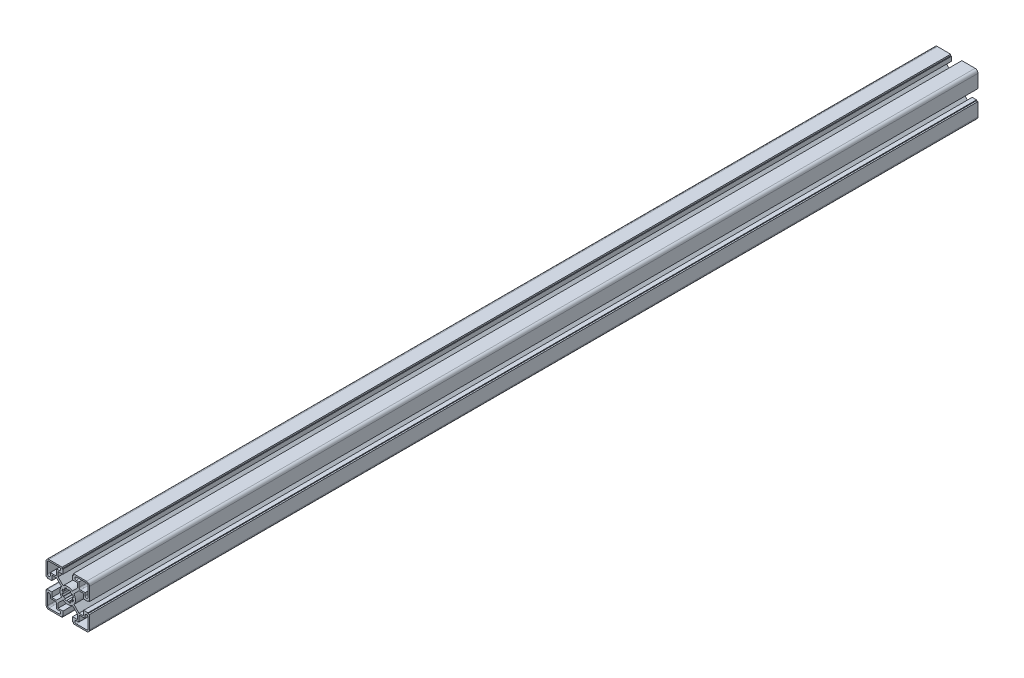
from build123d import *

# Parameters (mm, degrees)
BOSS_EXTRUDE1_DEPTH = 460


with BuildPart() as part:
    # Sketch1 → Boss-Extrude1 (new, symmetric)
    with BuildSketch(Plane.XY):
        with BuildLine():
            Line((-19.5072, 22.5044), (-5.7912, 22.5044))
            Line((-5.7912, 22.5044), (-5.7912, 21.0058))
            Line((-5.7912, 21.0058), (-5.0038, 21.0058))
            Line((-5.0038, 21.0058), (-5.0038, 16.51))
            Line((-5.0038, 16.51), (-10.0457, 16.51))
            Line((-10.0457, 16.51), (-10.0457, 11.680106614))
            Line((-10.0457, 11.680106614), (-4.781026704, 6.415433318))
            ThreePointArc((-4.781026704, 6.415433318), (0, 8.001), (4.781026704, 6.415433318))
            Line((4.781026704, 6.415433318), (10.0457, 11.680106614))
            Line((10.0457, 11.680106614), (10.0457, 16.51))
            Line((10.0457, 16.51), (5.0038, 16.51))
            Line((5.0038, 16.51), (5.0038, 21.0058))
            Line((5.0038, 21.0058), (5.7912, 21.0058))
            Line((5.7912, 21.0058), (5.7912, 22.5044))
            Line((5.7912, 22.5044), (19.5072, 22.5044))
            ThreePointArc((19.5072, 22.5044), (21.626540445, 21.626540445), (22.5044, 19.5072))
            Line((22.5044, 19.5072), (22.5044, 5.7912))
            Line((22.5044, 5.7912), (21.0058, 5.7912))
            Line((21.0058, 5.7912), (21.0058, 5.0038))
            Line((21.0058, 5.0038), (16.51, 5.0038))
            Line((16.51, 5.0038), (16.51, 10.0457))
            Line((16.51, 10.0457), (11.680106614, 10.0457))
            Line((11.680106614, 10.0457), (6.415433318, 4.781026704))
            ThreePointArc((6.415433318, 4.781026704), (8.001, 0), (6.415433318, -4.781026704))
            Line((6.415433318, -4.781026704), (11.680106614, -10.0457))
            Line((11.680106614, -10.0457), (16.51, -10.0457))
            Line((16.51, -10.0457), (16.51, -5.0038))
            Line((16.51, -5.0038), (21.0058, -5.0038))
            Line((21.0058, -5.0038), (21.0058, -5.7912))
            Line((21.0058, -5.7912), (22.5044, -5.7912))
            Line((22.5044, -5.7912), (22.5044, -19.5072))
            ThreePointArc((22.5044, -19.5072), (21.626540445, -21.626540445), (19.5072, -22.5044))
            Line((19.5072, -22.5044), (5.7912, -22.5044))
            Line((5.7912, -22.5044), (5.7912, -21.0058))
            Line((5.7912, -21.0058), (5.0038, -21.0058))
            Line((5.0038, -21.0058), (5.0038, -16.51))
            Line((5.0038, -16.51), (10.0457, -16.51))
            Line((10.0457, -16.51), (10.0457, -11.680106614))
            Line((10.0457, -11.680106614), (4.781026704, -6.415433318))
            ThreePointArc((4.781026704, -6.415433318), (0, -8.001), (-4.781026704, -6.415433318))
            Line((-4.781026704, -6.415433318), (-10.0457, -11.680106614))
            Line((-10.0457, -11.680106614), (-10.0457, -16.51))
            Line((-10.0457, -16.51), (-5.0038, -16.51))
            Line((-5.0038, -16.51), (-5.0038, -21.0058))
            Line((-5.0038, -21.0058), (-5.7912, -21.0058))
            Line((-5.7912, -21.0058), (-5.7912, -22.5044))
            Line((-5.7912, -22.5044), (-19.5072, -22.5044))
            ThreePointArc((-19.5072, -22.5044), (-21.626540445, -21.626540445), (-22.5044, -19.5072))
            Line((-22.5044, -19.5072), (-22.5044, -5.7912))
            Line((-22.5044, -5.7912), (-21.0058, -5.7912))
            Line((-21.0058, -5.7912), (-21.0058, -5.0038))
            Line((-21.0058, -5.0038), (-16.51, -5.0038))
            Line((-16.51, -5.0038), (-16.51, -10.0457))
            Line((-16.51, -10.0457), (-11.680106614, -10.0457))
            Line((-11.680106614, -10.0457), (-6.415433318, -4.781026704))
            ThreePointArc((-6.415433318, -4.781026704), (-8.001, 0), (-6.415433318, 4.781026704))
            Line((-6.415433318, 4.781026704), (-11.680106614, 10.0457))
            Line((-11.680106614, 10.0457), (-16.51, 10.0457))
            Line((-16.51, 10.0457), (-16.51, 5.0038))
            Line((-16.51, 5.0038), (-21.0058, 5.0038))
            Line((-21.0058, 5.0038), (-21.0058, 5.7912))
            Line((-21.0058, 5.7912), (-22.5044, 5.7912))
            Line((-22.5044, 5.7912), (-22.5044, 19.5072))
            ThreePointArc((-22.5044, 19.5072), (-21.626540445, 21.626540445), (-19.5072, 22.5044))
        make_face()
        with BuildLine():
            Line((-18.0086, 11.5443), (-13.0429, 11.5443))
            ThreePointArc((-13.0429, 11.5443), (-11.983229778, 11.983229778), (-11.5443, 13.0429))
            Line((-11.5443, 13.0429), (-11.5443, 18.0086))
            Line((-11.5443, 18.0086), (-8.7884, 18.0086))
            ThreePointArc((-8.7884, 18.0086), (-7.2898, 19.5072), (-8.7884, 21.0058))
            Line((-8.7884, 21.0058), (-19.5072, 21.0058))
            ThreePointArc((-19.5072, 21.0058), (-20.566870222, 20.566870222), (-21.0058, 19.5072))
            Line((-21.0058, 19.5072), (-21.0058, 8.7884))
            ThreePointArc((-21.0058, 8.7884), (-19.5072, 7.2898), (-18.0086, 8.7884))
            Line((-18.0086, 8.7884), (-18.0086, 11.5443))
        make_face(mode=Mode.SUBTRACT)
        with BuildLine():
            Line((1.189270603, 5.978867069), (0.976192953, 4.907653386))
            ThreePointArc((0.976192953, 4.907653386), (0, 5.0038), (-0.976192953, 4.907653386))
            Line((-0.976192953, 4.907653386), (-1.189270603, 5.978867069))
            ThreePointArc((-1.189270603, 5.978867069), (-2.332838204, 5.63196963), (-3.38675614, 5.068638757))
            Line((-3.38675614, 5.068638757), (-2.779962332, 4.160507646))
            ThreePointArc((-2.779962332, 4.160507646), (-3.538220912, 3.538220912), (-4.160507646, 2.779962332))
            Line((-4.160507646, 2.779962332), (-5.068638757, 3.38675614))
            ThreePointArc((-5.068638757, 3.38675614), (-5.63196963, 2.332838204), (-5.978867069, 1.189270603))
            Line((-5.978867069, 1.189270603), (-4.907653386, 0.976192953))
            ThreePointArc((-4.907653386, 0.976192953), (-5.0038, 0), (-4.907653386, -0.976192953))
            Line((-4.907653386, -0.976192953), (-5.978867069, -1.189270603))
            ThreePointArc((-5.978867069, -1.189270603), (-5.63196963, -2.332838204), (-5.068638757, -3.38675614))
            Line((-5.068638757, -3.38675614), (-4.160507646, -2.779962332))
            ThreePointArc((-4.160507646, -2.779962332), (-3.538220912, -3.538220912), (-2.779962332, -4.160507646))
            Line((-2.779962332, -4.160507646), (-3.38675614, -5.068638757))
            ThreePointArc((-3.38675614, -5.068638757), (-2.332838204, -5.63196963), (-1.189270603, -5.978867069))
            Line((-1.189270603, -5.978867069), (-0.976192953, -4.907653386))
            ThreePointArc((-0.976192953, -4.907653386), (0, -5.0038), (0.976192953, -4.907653386))
            Line((0.976192953, -4.907653386), (1.189270603, -5.978867069))
            ThreePointArc((1.189270603, -5.978867069), (2.332838204, -5.63196963), (3.38675614, -5.068638757))
            Line((3.38675614, -5.068638757), (2.779962332, -4.160507646))
            ThreePointArc((2.779962332, -4.160507646), (3.538220912, -3.538220912), (4.160507646, -2.779962332))
            Line((4.160507646, -2.779962332), (5.068638757, -3.38675614))
            ThreePointArc((5.068638757, -3.38675614), (5.63196963, -2.332838204), (5.978867069, -1.189270603))
            Line((5.978867069, -1.189270603), (4.907653386, -0.976192953))
            ThreePointArc((4.907653386, -0.976192953), (5.0038, 0), (4.907653386, 0.976192953))
            Line((4.907653386, 0.976192953), (5.978867069, 1.189270603))
            ThreePointArc((5.978867069, 1.189270603), (5.63196963, 2.332838204), (5.068638757, 3.38675614))
            Line((5.068638757, 3.38675614), (4.160507646, 2.779962332))
            ThreePointArc((4.160507646, 2.779962332), (3.538220912, 3.538220912), (2.779962332, 4.160507646))
            Line((2.779962332, 4.160507646), (3.38675614, 5.068638757))
            ThreePointArc((3.38675614, 5.068638757), (2.332838204, 5.63196963), (1.189270603, 5.978867069))
        make_face(mode=Mode.SUBTRACT)
        with BuildLine():
            Line((11.5443, 18.0086), (8.7884, 18.0086))
            ThreePointArc((8.7884, 18.0086), (7.2898, 19.5072), (8.7884, 21.0058))
            Line((8.7884, 21.0058), (19.5072, 21.0058))
            ThreePointArc((19.5072, 21.0058), (20.566870222, 20.566870222), (21.0058, 19.5072))
            Line((21.0058, 19.5072), (21.0058, 8.7884))
            ThreePointArc((21.0058, 8.7884), (19.5072, 7.2898), (18.0086, 8.7884))
            Line((18.0086, 8.7884), (18.0086, 11.5443))
            Line((18.0086, 11.5443), (13.0429, 11.5443))
            ThreePointArc((13.0429, 11.5443), (11.983229778, 11.983229778), (11.5443, 13.0429))
            Line((11.5443, 13.0429), (11.5443, 18.0086))
        make_face(mode=Mode.SUBTRACT)
        with BuildLine():
            Line((18.0086, -11.5443), (13.0429, -11.5443))
            ThreePointArc((13.0429, -11.5443), (11.983229778, -11.983229778), (11.5443, -13.0429))
            Line((11.5443, -13.0429), (11.5443, -18.0086))
            Line((11.5443, -18.0086), (8.7884, -18.0086))
            ThreePointArc((8.7884, -18.0086), (7.2898, -19.5072), (8.7884, -21.0058))
            Line((8.7884, -21.0058), (19.5072, -21.0058))
            ThreePointArc((19.5072, -21.0058), (20.566870222, -20.566870222), (21.0058, -19.5072))
            Line((21.0058, -19.5072), (21.0058, -8.7884))
            ThreePointArc((21.0058, -8.7884), (19.5072, -7.2898), (18.0086, -8.7884))
            Line((18.0086, -8.7884), (18.0086, -11.5443))
        make_face(mode=Mode.SUBTRACT)
        with BuildLine():
            Line((-11.5443, -18.0086), (-8.7884, -18.0086))
            ThreePointArc((-8.7884, -18.0086), (-7.2898, -19.5072), (-8.7884, -21.0058))
            Line((-8.7884, -21.0058), (-19.5072, -21.0058))
            ThreePointArc((-19.5072, -21.0058), (-20.566870222, -20.566870222), (-21.0058, -19.5072))
            Line((-21.0058, -19.5072), (-21.0058, -8.7884))
            ThreePointArc((-21.0058, -8.7884), (-19.5072, -7.2898), (-18.0086, -8.7884))
            Line((-18.0086, -8.7884), (-18.0086, -11.5443))
            Line((-18.0086, -11.5443), (-13.0429, -11.5443))
            ThreePointArc((-13.0429, -11.5443), (-11.983229778, -11.983229778), (-11.5443, -13.0429))
            Line((-11.5443, -13.0429), (-11.5443, -18.0086))
        make_face(mode=Mode.SUBTRACT)
    extrude(amount=BOSS_EXTRUDE1_DEPTH, both=True)


solid = part.part
